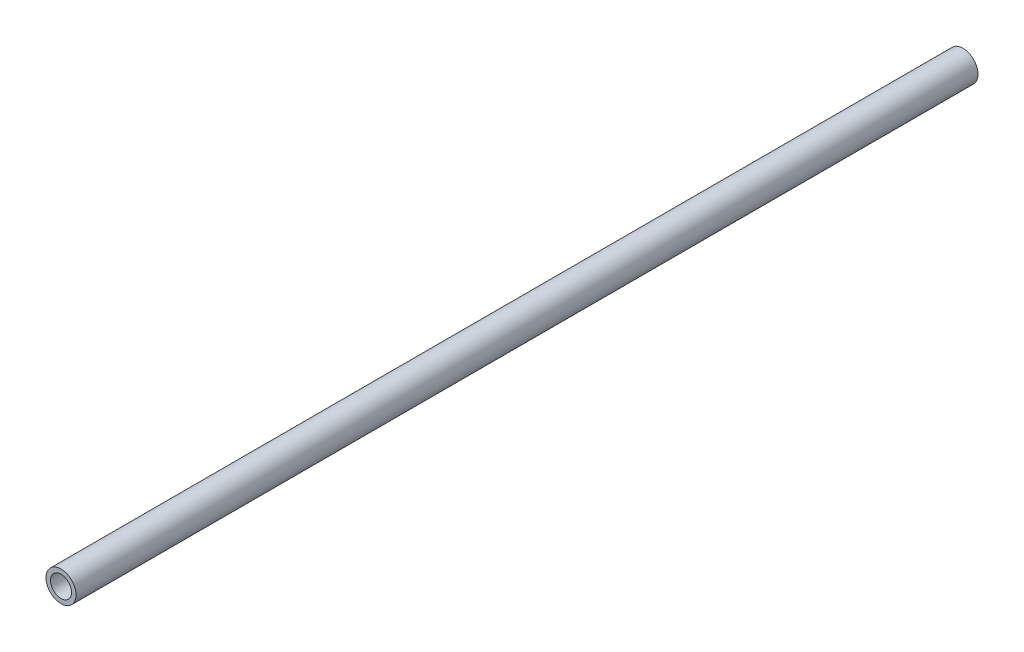
from build123d import *

# Parameters (mm, degrees)
SKETCH1_R           = 25
SKETCH1_R_2         = 17.5
BOSS_EXTRUDE1_DEPTH = 1500


with BuildPart() as part:
    # Sketch1 → Boss-Extrude1 (new body)
    with BuildSketch(Plane.XY):
        Circle(SKETCH1_R)
        Circle(SKETCH1_R_2, mode=Mode.SUBTRACT)
    extrude(amount=BOSS_EXTRUDE1_DEPTH)


solid = part.part
